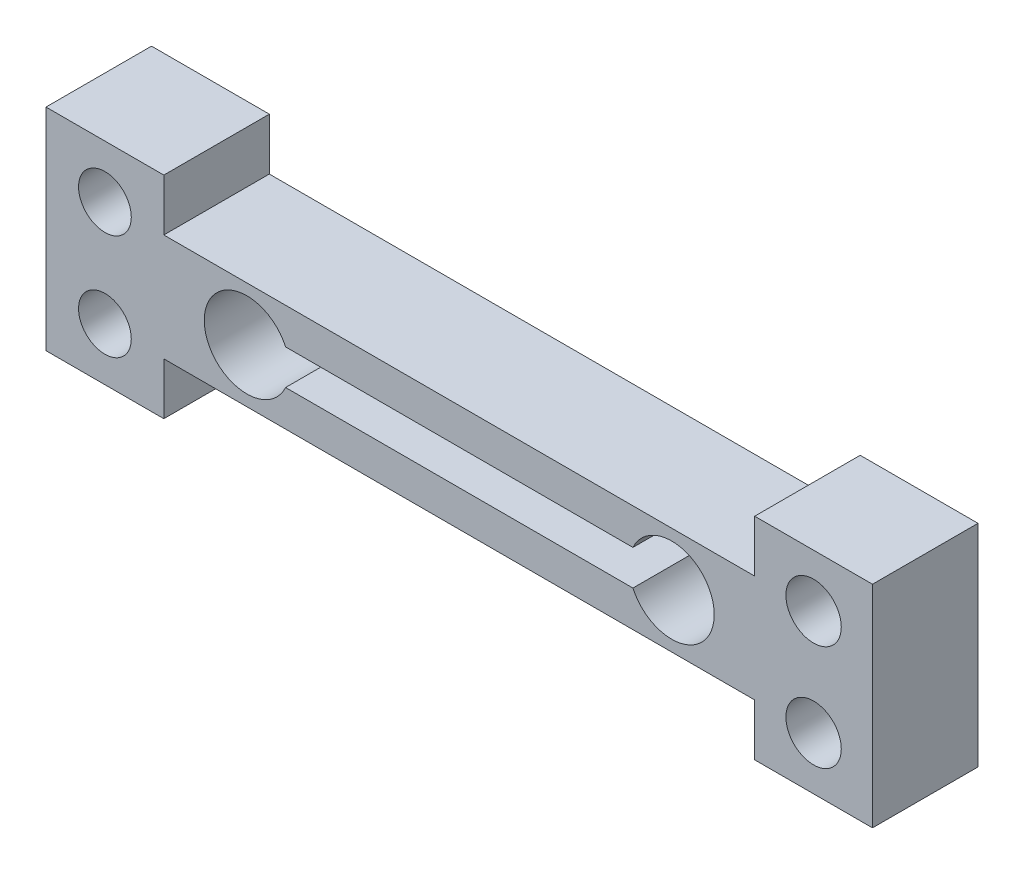
from build123d import *

# Parameters (mm, degrees)
SKETCH1_R           = 1.575
SKETCH1_R_2         = 1.5
BOSS_EXTRUDE1_DEPTH = 3
CUT_EXTRUDE1_DEPTH  = 45.467094576


with BuildPart() as part:
    # Sketch1 → Boss-Extrude1 (new, symmetric)
    with BuildSketch(Plane.XY):
        Polygon((-3.35, 6), (3.35, 6), (3.35, 3.05), (36.95, 3.05), (36.95, 6), (43.65, 6), (43.65, -6), (36.95, -6), (36.95, -3.05), (3.35, -3.05), (3.35, -6), (-3.35, -6), align=None)
        with Locations((40.3, 3)):
            Circle(SKETCH1_R, mode=Mode.SUBTRACT)
        with Locations((40.3, -3)):
            Circle(SKETCH1_R, mode=Mode.SUBTRACT)
        with Locations((0, 3)):
            Circle(SKETCH1_R_2, mode=Mode.SUBTRACT)
        with Locations((0, -3)):
            Circle(SKETCH1_R_2, mode=Mode.SUBTRACT)
    extrude(amount=BOSS_EXTRUDE1_DEPTH, both=True)

    # Sketch4 → Cut-Extrude1 (cut, through all)
    with BuildSketch(Plane.XY.offset(3)):
        with BuildLine():
            Line((10.273724121, 1), (30.026275879, 1))
            ThreePointArc((30.026275879, 1), (34.65, 0), (30.026275879, -1))
            Line((30.026275879, -1), (10.273724121, -1))
            ThreePointArc((10.273724121, -1), (5.65, 0), (10.273724121, 1))
        make_face()
    extrude(amount=-CUT_EXTRUDE1_DEPTH, mode=Mode.SUBTRACT)


solid = part.part
